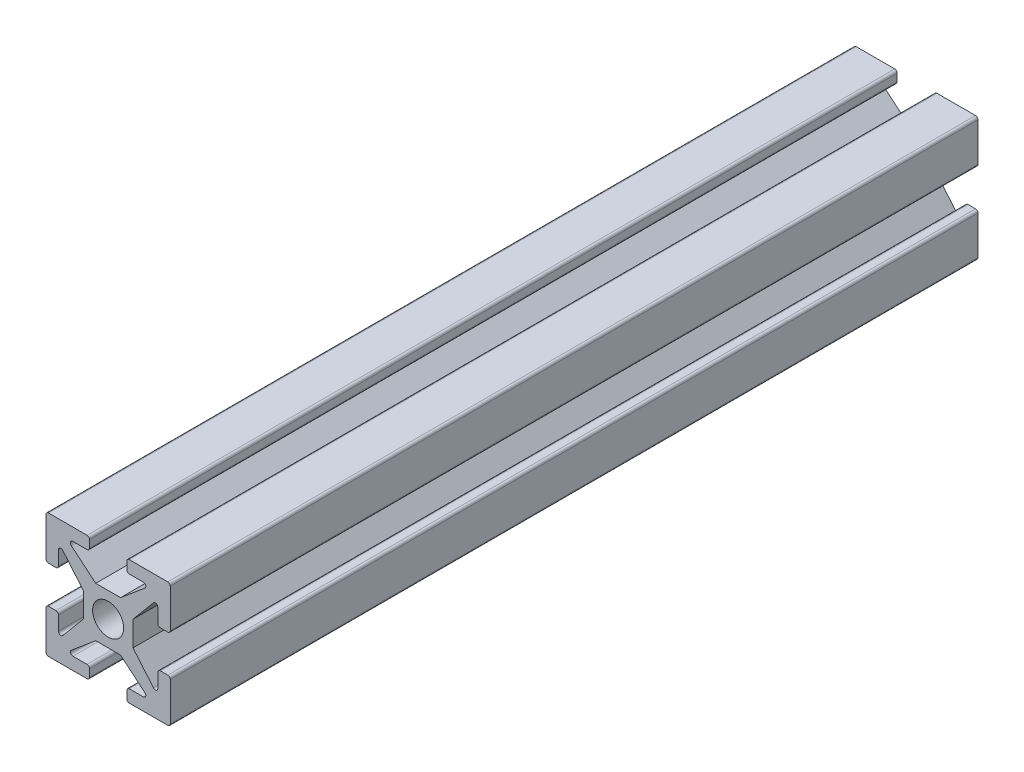
from build123d import *

# Parameters (mm, degrees)
SKETCH1_R           = 1.25
BOSS_EXTRUDE1_DEPTH = 65


with BuildPart() as part:
    # Sketch1 → Boss-Extrude1 (new body)
    with BuildSketch(Plane.XY):
        with BuildLine():
            Line((-4.8, 5), (-1.7, 5))
            ThreePointArc((-1.7, 5), (-1.558578644, 4.941421356), (-1.5, 4.8))
            Line((-1.5, 4.8), (-1.5, 4.2))
            ThreePointArc((-1.5, 4.2), (-1.558578644, 4.058578644), (-1.7, 4))
            Line((-1.7, 4), (-2.834011701, 4))
            ThreePointArc((-2.834011701, 4), (-3.021950225, 3.868404029), (-2.962569223, 3.646791111))
            Line((-2.962569223, 3.646791111), (-1, 2))
            Line((-1, 2), (1, 2))
            Line((1, 2), (2.962569223, 3.646791111))
            ThreePointArc((2.962569223, 3.646791111), (3.021950225, 3.868404029), (2.834011701, 4))
            Line((2.834011701, 4), (1.7, 4))
            ThreePointArc((1.7, 4), (1.558578644, 4.058578644), (1.5, 4.2))
            Line((1.5, 4.2), (1.5, 4.8))
            ThreePointArc((1.5, 4.8), (1.558578644, 4.941421356), (1.7, 5))
            Line((1.7, 5), (4.8, 5))
            ThreePointArc((4.8, 5), (4.941421356, 4.941421356), (5, 4.8))
            Line((5, 4.8), (5, 1.7))
            ThreePointArc((5, 1.7), (4.941421356, 1.558578644), (4.8, 1.5))
            Line((4.8, 1.5), (4.2, 1.5))
            ThreePointArc((4.2, 1.5), (4.058578644, 1.558578644), (4, 1.7))
            Line((4, 1.7), (4, 2.834011701))
            ThreePointArc((4, 2.834011701), (3.868404029, 3.021950225), (3.646791111, 2.962569223))
            Line((3.646791111, 2.962569223), (2, 1))
            Line((2, 1), (2, -1))
            Line((2, -1), (3.646791111, -2.962569223))
            ThreePointArc((3.646791111, -2.962569223), (3.868404029, -3.021950225), (4, -2.834011701))
            Line((4, -2.834011701), (4, -1.7))
            ThreePointArc((4, -1.7), (4.058578644, -1.558578644), (4.2, -1.5))
            Line((4.2, -1.5), (4.8, -1.5))
            ThreePointArc((4.8, -1.5), (4.941421356, -1.558578644), (5, -1.7))
            Line((5, -1.7), (5, -4.8))
            ThreePointArc((5, -4.8), (4.941421356, -4.941421356), (4.8, -5))
            Line((4.8, -5), (1.7, -5))
            ThreePointArc((1.7, -5), (1.558578644, -4.941421356), (1.5, -4.8))
            Line((1.5, -4.8), (1.5, -4.2))
            ThreePointArc((1.5, -4.2), (1.558578644, -4.058578644), (1.7, -4))
            Line((1.7, -4), (2.834011701, -4))
            ThreePointArc((2.834011701, -4), (3.021950225, -3.868404029), (2.962569223, -3.646791111))
            Line((2.962569223, -3.646791111), (1, -2))
            Line((1, -2), (-1, -2))
            Line((-1, -2), (-2.962569223, -3.646791111))
            ThreePointArc((-2.962569223, -3.646791111), (-3.021950225, -3.868404029), (-2.834011701, -4))
            Line((-2.834011701, -4), (-1.7, -4))
            ThreePointArc((-1.7, -4), (-1.558578644, -4.058578644), (-1.5, -4.2))
            Line((-1.5, -4.2), (-1.5, -4.8))
            ThreePointArc((-1.5, -4.8), (-1.558578644, -4.941421356), (-1.7, -5))
            Line((-1.7, -5), (-4.8, -5))
            ThreePointArc((-4.8, -5), (-4.941421356, -4.941421356), (-5, -4.8))
            Line((-5, -4.8), (-5, -1.7))
            ThreePointArc((-5, -1.7), (-4.941421356, -1.558578644), (-4.8, -1.5))
            Line((-4.8, -1.5), (-4.2, -1.5))
            ThreePointArc((-4.2, -1.5), (-4.058578644, -1.558578644), (-4, -1.7))
            Line((-4, -1.7), (-4, -2.834011701))
            ThreePointArc((-4, -2.834011701), (-3.868404029, -3.021950225), (-3.646791111, -2.962569223))
            Line((-3.646791111, -2.962569223), (-2, -1))
            Line((-2, -1), (-2, 1))
            Line((-2, 1), (-3.646791111, 2.962569223))
            ThreePointArc((-3.646791111, 2.962569223), (-3.868404029, 3.021950225), (-4, 2.834011701))
            Line((-4, 2.834011701), (-4, 1.7))
            ThreePointArc((-4, 1.7), (-4.058578644, 1.558578644), (-4.2, 1.5))
            Line((-4.2, 1.5), (-4.8, 1.5))
            ThreePointArc((-4.8, 1.5), (-4.941421356, 1.558578644), (-5, 1.7))
            Line((-5, 1.7), (-5, 4.8))
            ThreePointArc((-5, 4.8), (-4.941421356, 4.941421356), (-4.8, 5))
        make_face()
        Circle(SKETCH1_R, mode=Mode.SUBTRACT)
    extrude(amount=BOSS_EXTRUDE1_DEPTH)


solid = part.part
